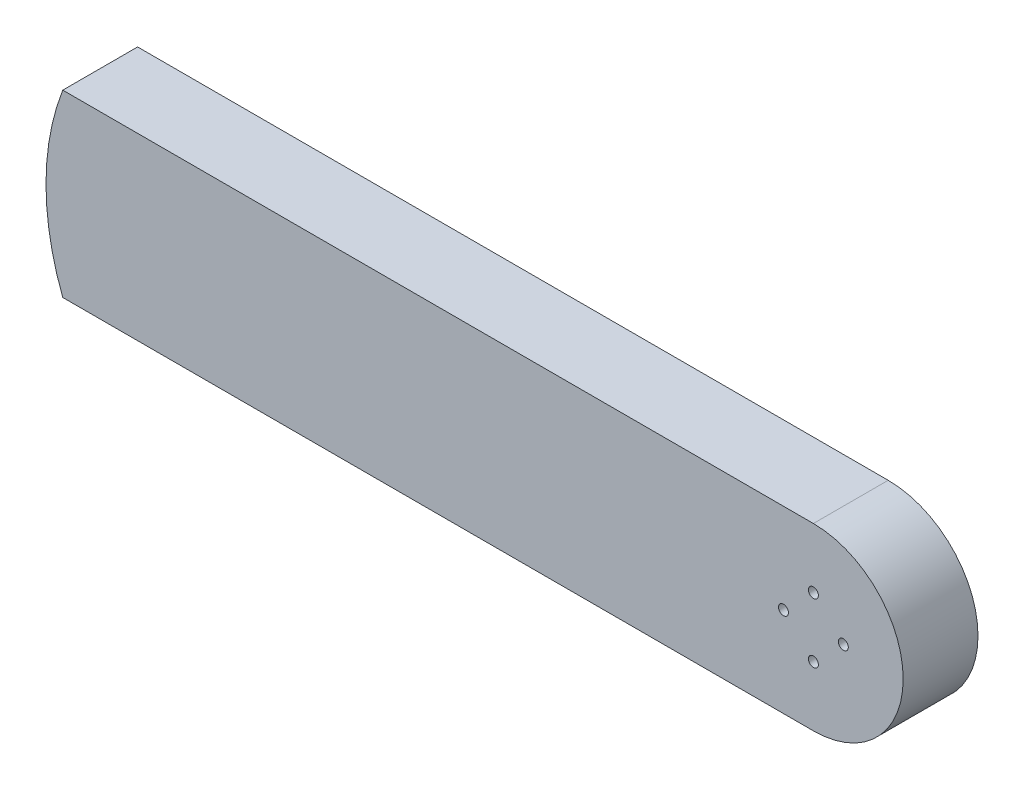
from build123d import *

# Parameters (mm, degrees)
SKETCH_1_W          = 300
SKETCH_1_H          = 36
EXTRUDE_1_DEPTH     = 15
SKETCH_2_R          = 1
CUT_EXTRUDE_2_DEPTH = 5
CUT_EXTRUDE_3_DEPTH = 10
CUT_EXTRUDE_4_REACH = 304.524
SKETCH_5_R          = 1
CUT_EXTRUDE_5_DEPTH = 5
CUT_EXTRUDE_6_REACH = 178.2


with BuildPart() as part:
    # 草图1 → 凸台-拉伸1 (new body)
    with BuildSketch(Plane.XY):
        with Locations((150, 18)):
            Rectangle(SKETCH_1_W, SKETCH_1_H)
    extrude(amount=EXTRUDE_1_DEPTH)

    # 草图2 → 切除-拉伸2 (cut)
    with BuildSketch(Plane.XY):
        with Locations((9.018599779, 31)):
            Circle(SKETCH_2_R)
        with Locations((9.018599779, 5)):
            Circle(SKETCH_2_R)
        with Locations((7, 18)):
            Circle(SKETCH_2_R)
        with Locations((90.721400221, 5)):
            Circle(SKETCH_2_R)
        with Locations((90.721400221, 31)):
            Circle(SKETCH_2_R)
        with Locations((92.74, 18)):
            Circle(SKETCH_2_R)
    extrude(amount=CUT_EXTRUDE_2_DEPTH, mode=Mode.SUBTRACT)

    # 草图3 → 切除-拉伸3 (cut)
    with BuildSketch(Plane(origin=(0, 0, 0), x_dir=(-1, 0, 0), z_dir=(0, 0, -1))):
        Polygon((-145.169424203, 23), (-153.829678241, 28), (-162.489932279, 23), (-162.489932279, 13), (-153.829678241, 8), (-145.169424203, 13), align=None)
    extrude(amount=-CUT_EXTRUDE_3_DEPTH, mode=Mode.SUBTRACT)

    # 草图4 → 切除-拉伸4 (cut, up to next)
    with BuildSketch(Plane.XY.offset(15), mode=Mode.PRIVATE) as cut_extrude_4_sk1:
        with BuildLine():
            Line((300, 36), (153.829678241, 36))
            ThreePointArc((153.829678241, 36), (171.829678241, 18), (153.829678241, 0))
            Line((153.829678241, 0), (300, 0))
            Line((300, 0), (300, 36))
        make_face()
    cut_extrude_4_tool1 = extrude(cut_extrude_4_sk1.sketch, amount=-CUT_EXTRUDE_4_REACH, mode=Mode.PRIVATE) & part.part
    add(cut_extrude_4_tool1.solids().sort_by_distance((233.9223, 18, 15))[0], mode=Mode.SUBTRACT)

    # 草图5 → 切除-拉伸5 (cut)
    with BuildSketch(Plane(origin=(0, 0, 10), x_dir=(-1, 0, 0), z_dir=(0, 0, -1))):
        with Locations((-153.829678241, 24)):
            Circle(SKETCH_5_R)
        with Locations((-147.829678241, 18)):
            Circle(SKETCH_5_R)
        with Locations((-159.829678241, 18)):
            Circle(SKETCH_5_R)
        with Locations((-153.829678241, 12)):
            Circle(SKETCH_5_R)
    extrude(amount=-CUT_EXTRUDE_5_DEPTH, mode=Mode.SUBTRACT)

    # 草图6 → 切除-拉伸6 (cut, up to next)
    with BuildSketch(Plane(origin=(0, 0, 0), x_dir=(-1, 0, 0), z_dir=(0, 0, -1)), mode=Mode.PRIVATE) as cut_extrude_6_sk1:
        with BuildLine():
            ThreePointArc((0, 18), (-0.847642328, 8.844381598), (-3.361754494, 0))
            Line((-3.361754494, 0), (0, 0))
            Line((0, 0), (0, 18))
        make_face()
    cut_extrude_6_tool1 = extrude(cut_extrude_6_sk1.sketch, amount=-CUT_EXTRUDE_6_REACH, mode=Mode.PRIVATE) & part.part
    # 草图6 → 切除-拉伸6 (cut, up to next)
    with BuildSketch(Plane(origin=(0, 0, 0), x_dir=(-1, 0, 0), z_dir=(0, 0, -1)), mode=Mode.PRIVATE) as cut_extrude_6_sk2:
        with BuildLine():
            ThreePointArc((-3.361754494, 36), (-0.847642328, 27.155618402), (0, 18))
            Line((0, 18), (0, 36))
            Line((0, 36), (-3.361754494, 36))
        make_face()
    cut_extrude_6_tool2 = extrude(cut_extrude_6_sk2.sketch, amount=-CUT_EXTRUDE_6_REACH, mode=Mode.PRIVATE) & part.part
    add(cut_extrude_6_tool1.solids().sort_by_distance((1.002419, 4.469106, 0))[0], mode=Mode.SUBTRACT)
    add(cut_extrude_6_tool2.solids().sort_by_distance((1.002419, 31.530894, 0))[0], mode=Mode.SUBTRACT)


solid = part.part
